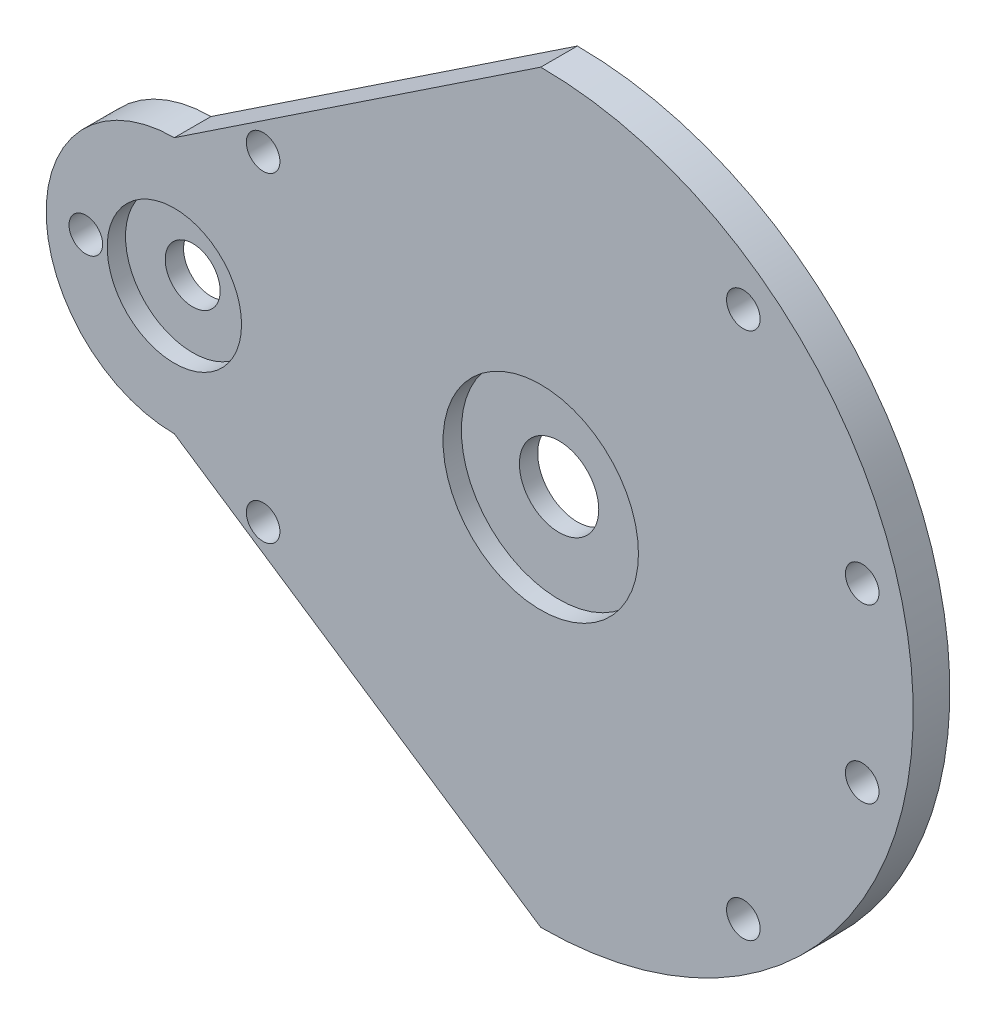
from build123d import *

# Parameters (mm, degrees)
BOSS_EXTRU_1_DEPTH           = 3
ESQUISSE2_R                  = 11
ESQUISSE2_R_2                = 16
ENL_V_MAT_EXTRU_1_DEPTH      = 3
ESQUISSE3_R                  = 4.5
ESQUISSE3_R_2                = 6.5
ENL_V_MAT_EXTRU_2_DEPTH      = 3
ENL_V_MAT_EXTRU_3_DEPTH      = 136.639227364
ENL_V_MAT_EXTRU_3_DEPTH_BACK = 136.639227364
ESQUISSE7_R                  = 2.75


with BuildPart() as part:
    # Esquisse1 → Boss.-Extru.1 (new, symmetric)
    with BuildSketch(Plane.XY):
        with BuildLine():
            Line((0, -21), (60, -61))
            ThreePointArc((60, -61), (121, 0), (60, 61))
            Line((60, 61), (0, 21))
            ThreePointArc((0, 21), (-21, 0), (0, -21))
        make_face()
    extrude(amount=BOSS_EXTRU_1_DEPTH, both=True)

    # Esquisse2 → Enlèv. mat.-Extru.1 (cut)
    with BuildSketch(Plane.XY.offset(3)):
        Circle(ESQUISSE2_R)
        with Locations((60, 0)):
            Circle(ESQUISSE2_R_2)
    extrude(amount=-ENL_V_MAT_EXTRU_1_DEPTH, mode=Mode.SUBTRACT)

    # Esquisse3 → Enlèv. mat.-Extru.2 (cut)
    with BuildSketch(Plane.XY):
        Circle(ESQUISSE3_R)
        with Locations((60, 0)):
            Circle(ESQUISSE3_R_2)
    extrude(amount=-ENL_V_MAT_EXTRU_2_DEPTH, mode=Mode.SUBTRACT)

    # Esquisse7 → Enlèv. mat.-Extru.3 (cut, two sides: drawn at the far end of the back side and taken through both)
    with BuildSketch(Plane(origin=(0, 0, -3), x_dir=(-1, 0, 0), z_dir=(0, 0, -1)).offset(-ENL_V_MAT_EXTRU_3_DEPTH_BACK)):
        with Locations((-93.177497881, 43.237757046)):
            Circle(ESQUISSE7_R)
        with Locations((-112.642957533, 14.105637958)):
            Circle(ESQUISSE7_R)
        with Locations((-93.177497881, -43.237757046)):
            Circle(ESQUISSE7_R)
        with Locations((-112.642957533, -14.105637958)):
            Circle(ESQUISSE7_R)
        with Locations((14.5, 0)):
            Circle(ESQUISSE7_R)
        with Locations((-14.533666301, 26.25)):
            Circle(ESQUISSE7_R)
        with Locations((-14.533666301, -26.25)):
            Circle(ESQUISSE7_R)
    extrude(amount=ENL_V_MAT_EXTRU_3_DEPTH + ENL_V_MAT_EXTRU_3_DEPTH_BACK, mode=Mode.SUBTRACT)


solid = part.part
